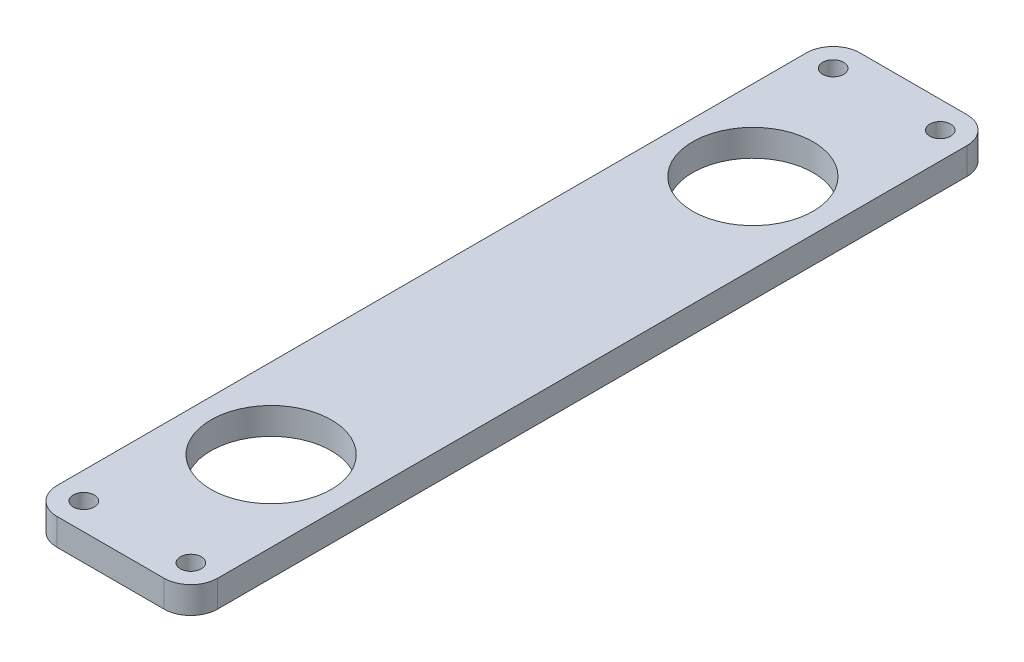
from build123d import *

# Parameters (mm, degrees)
SKETCH1_W           = 38.1
SKETCH1_H           = 190.5
SKETCH1_R           = 14.2875
SKETCH1_R_2         = 2.4892
BOSS_EXTRUDE1_DEPTH = 3.175
FILLET1_R           = 6.35


with BuildPart() as part:
    # Sketch1 → Boss-Extrude1 (new, symmetric)
    with BuildSketch(Plane(origin=(0, 0, 0), x_dir=(1, 0, 0), z_dir=(0, 1, 0))):
        with Locations((0, 57.15)):
            Rectangle(SKETCH1_W, SKETCH1_H)
        with Locations(Location((0, 0, 0), (0, 0, 270))):
            Circle(SKETCH1_R, mode=Mode.SUBTRACT)
        with Locations(Location((0, 114.3, 0), (0, 0, 270))):
            Circle(SKETCH1_R, mode=Mode.SUBTRACT)
        with Locations(Location((-12.7, 146.05, 0), (0, 0, 270))):
            Circle(SKETCH1_R_2, mode=Mode.SUBTRACT)
        with Locations(Location((12.7, 146.05, 0), (0, 0, 270))):
            Circle(SKETCH1_R_2, mode=Mode.SUBTRACT)
        with Locations(Location((-12.7, -31.75, 0), (0, 0, 270))):
            Circle(SKETCH1_R_2, mode=Mode.SUBTRACT)
        with Locations(Location((12.7, -31.75, 0), (0, 0, 270))):
            Circle(SKETCH1_R_2, mode=Mode.SUBTRACT)
    extrude(amount=BOSS_EXTRUDE1_DEPTH, both=True)

    # Fillet1
    fillet1_edges = [part.edges().sort_by_distance(p)[0] for p in [
        (-19.05, 0, -152.4),
        (19.05, 0, -152.4),
        (19.05, 0, 38.1),
        (-19.05, 0, 38.1),
    ]]
    fillet(fillet1_edges, radius=FILLET1_R)


solid = part.part
